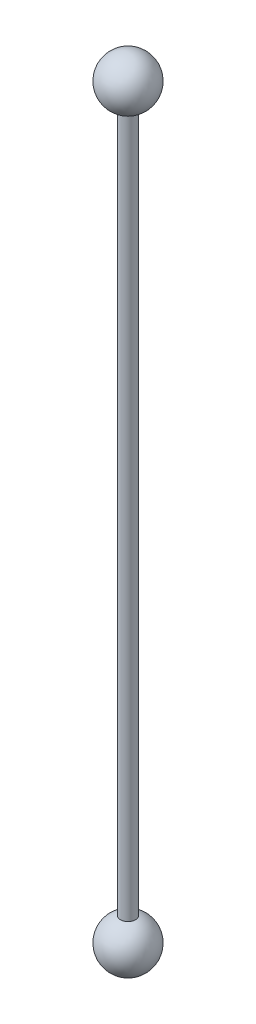
from build123d import *

# Parameters (mm, degrees)
SKETCH1_R           = 1.5
BOSS_EXTRUDE1_DEPTH = 150


with BuildPart() as part:
    # Sketch1 → Boss-Extrude1 (new body)
    with BuildSketch(Plane(origin=(0, 0, 0), x_dir=(1, 0, 0), z_dir=(0, 1, 0))):
        with Locations(Location((0, 0, 0), (0, 0, 270))):
            Circle(SKETCH1_R)
    extrude(amount=BOSS_EXTRUDE1_DEPTH)

    # Sketch2 → Revolve1 (revolve)
    with BuildSketch(Plane(origin=(0, 0, 0), x_dir=(0, 0, -1), z_dir=(1, 0, 0))):
        with BuildLine():
            Line((0, 5), (0, -5))
            ThreePointArc((0, -5), (5, 0), (0, 5))
        make_face()
    revolve1 = revolve(axis=Axis((0, 5, 0), (0, -1, 0)))

    # Mirror1: Revolve1 across plane
    add(revolve1.mirror(Plane.ZX.offset(75)))


solid = part.part
